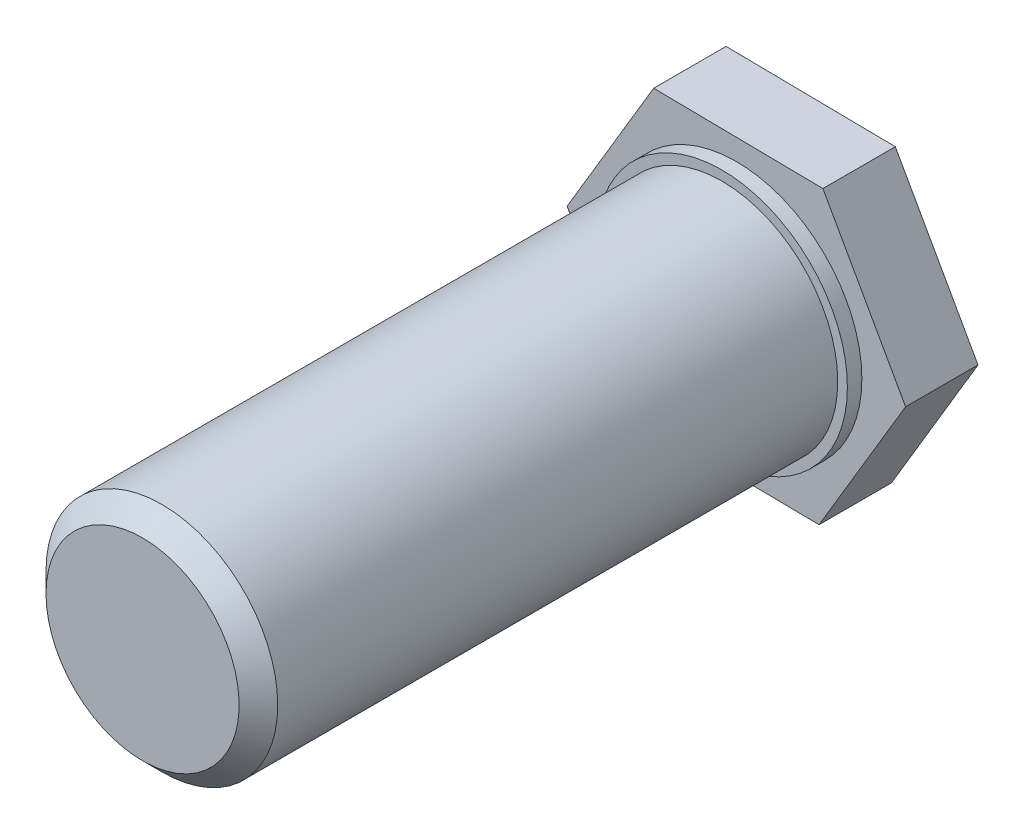
from build123d import *

# Parameters (mm, degrees)
BOSS_EXTRUDE6_DEPTH  = 1.5
SKETCH4_R            = 2.6
BOSS_EXTRUDE7_DEPTH  = 0.3
SKETCH5_R            = 2.4
BOSS_EXTRUDE10_DEPTH = 12
CHAMFER3_SIZE        = 0.4


with BuildPart() as part:
    # Sketch2 → Boss-Extrude6 (new body)
    with BuildSketch(Plane.XY):
        Polygon((1.792912768, 3.012681291), (-1.712602147, 3.05904865), (-3.505514916, 0.046367359), (-1.792912768, -3.012681291), (1.712602147, -3.05904865), (3.505514916, -0.046367359), align=None)
    extrude(amount=BOSS_EXTRUDE6_DEPTH)

    # Sketch4 → Boss-Extrude7 (add)
    with BuildSketch(Plane.XY.offset(1.5)):
        Circle(SKETCH4_R)
    extrude(amount=BOSS_EXTRUDE7_DEPTH)

    # Sketch5 → Boss-Extrude10 (add)
    with BuildSketch(Plane.XY.offset(1.8)):
        Circle(SKETCH5_R)
    extrude(amount=BOSS_EXTRUDE10_DEPTH)

    # Chamfer3
    chamfer3_edges = [part.edges().sort_by_distance(p)[0] for p in [
        (-2.4, 0, 13.8),
    ]]
    chamfer(chamfer3_edges, length=CHAMFER3_SIZE)


solid = part.part
